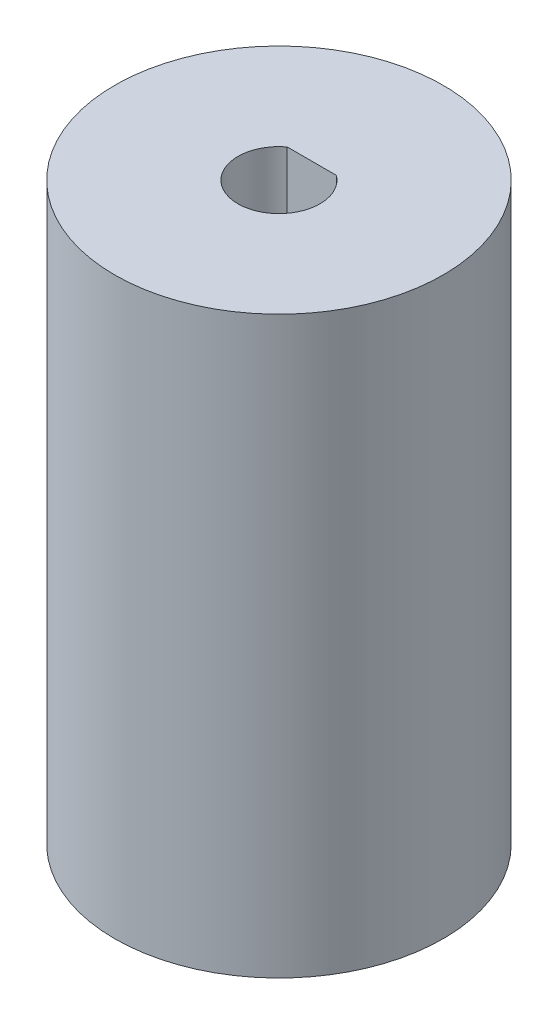
from build123d import *

# Parameters (mm, degrees)
SKETCH1_R           = 10
BOSS_EXTRUDE1_DEPTH = 35
SKETCH3_R           = 4
CUT_EXTRUDE2_DEPTH  = 15
CUT_EXTRUDE1_DEPTH  = 15


with BuildPart() as part:
    # Sketch1 → Boss-Extrude1 (new body)
    with BuildSketch(Plane(origin=(0, 0, 0), x_dir=(1, 0, 0), z_dir=(0, 1, 0))):
        with Locations(Location((0, 0, 0), (0, 0, 270))):
            Circle(SKETCH1_R)
    extrude(amount=BOSS_EXTRUDE1_DEPTH)

    # Sketch3 → Cut-Extrude2 (cut)
    with BuildSketch(Plane.XZ):
        with Locations(Location((0, 0, 0), (0, 0, 270))):
            Circle(SKETCH3_R)
    extrude(amount=-CUT_EXTRUDE2_DEPTH, mode=Mode.SUBTRACT)

    # Sketch2 → Cut-Extrude1 (cut)
    with BuildSketch(Plane(origin=(0, 35, 0), x_dir=(1, 0, 0), z_dir=(0, 1, 0))):
        with BuildLine():
            Line((1.5, 2), (-1.5, 2))
            ThreePointArc((-1.5, 2), (-1.118033989, -2.236067977), (2.5, 0))
            ThreePointArc((2.5, 0), (2.236067977, 1.118033989), (1.5, 2))
        make_face()
    extrude(amount=-CUT_EXTRUDE1_DEPTH, mode=Mode.SUBTRACT)


solid = part.part
